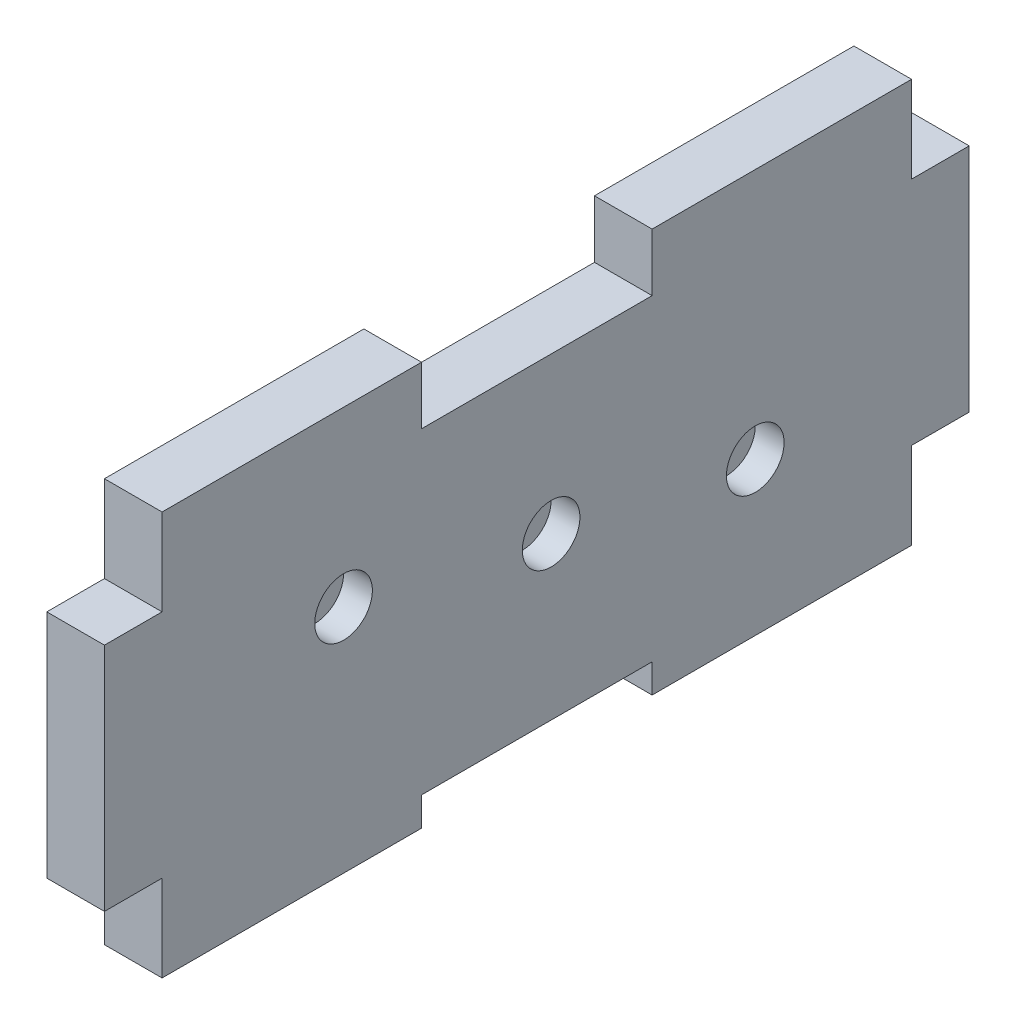
from build123d import *

# Parameters (mm, degrees)
BOSS_EXTRUDE1_DEPTH = 5
SKETCH5_R           = 5
CUT_EXTRUDE4_DEPTH  = 5
SKETCH2_R           = 5
CUT_EXTRUDE5_DEPTH  = 5
BOSS_EXTRUDE2_DEPTH = 5


with BuildPart() as part:
    # Sketch1 → Boss-Extrude1 (new body)
    with BuildSketch(Plane(origin=(0, 0, 0), x_dir=(0, 0, -1), z_dir=(1, 0, 0))):
        Polygon((-95, 70), (-140, 70), (-140, 55), (-150, 55), (-150, 15), (-140, 15), (-140, 0), (-95, 0), (-95, 5), (-55, 5), (-55, 0), (-10, 0), (-10, 15), (0, 15), (0, 55), (-10, 55), (-10, 70), (-55, 70), (-55, 60), (-95, 60), align=None)
    extrude(amount=BOSS_EXTRUDE1_DEPTH)

    # Sketch5 → Cut-Extrude4 (cut)
    with BuildSketch(Plane.ZY):
        with Locations((37.111667647, 26.5)):
            Circle(SKETCH5_R)
        with Locations((72.52, 33)):
            Circle(SKETCH5_R)
    extrude(amount=-CUT_EXTRUDE4_DEPTH, mode=Mode.SUBTRACT)

    # Sketch2 → Cut-Extrude5 (cut)
    with BuildSketch(Plane(origin=(5, 0, 0), x_dir=(0, 0, -1), z_dir=(1, 0, 0))):
        with Locations((-108.52, 40)):
            Circle(SKETCH2_R)
    extrude(amount=-CUT_EXTRUDE5_DEPTH, mode=Mode.SUBTRACT)

    # Sketch6 → Boss-Extrude2 (add)
    with BuildSketch(Plane.ZY):
        Polygon((55, 0), (55, 5), (95, 5), (95, 0), (140, 0), (140, 15), (150, 15), (150, 55), (140, 55), (140, 70), (95, 70), (95, 60), (55, 60), (55, 70), (10, 70), (10, 55), (0, 55), (0, 15), (10, 15), (10, 0), align=None)
    extrude(amount=BOSS_EXTRUDE2_DEPTH)


solid = part.part
